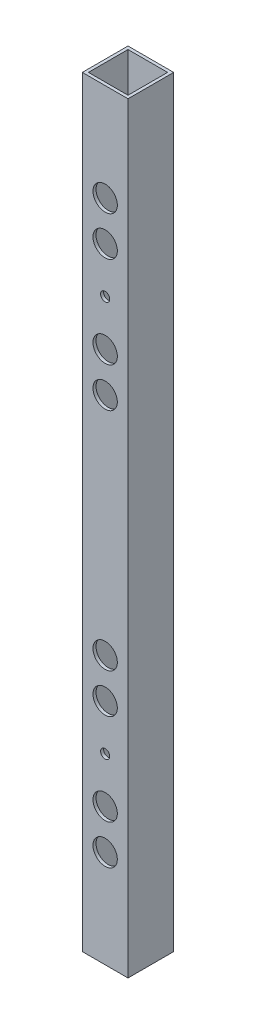
from build123d import *

# Parameters (mm, degrees)
SKETCH_1_W          = 15
SKETCH_1_H          = 15
SKETCH_1_W_2        = 13
SKETCH_1_H_2        = 13
EXTRUDE_1_DEPTH     = 250
SKETCH_2_R          = 1.5
CUT_EXTRUDE_1_DEPTH = 250
SKETCH_3_R          = 4
CUT_EXTRUDE_2_DEPTH = 2
SKETCH_4_R          = 4
CUT_EXTRUDE_3_DEPTH = 2


with BuildPart() as part:
    # 草图1 → 凸台-拉伸1 (new body)
    with BuildSketch(Plane(origin=(0, 0, 0), x_dir=(1, 0, 0), z_dir=(0, 1, 0))):
        Rectangle(SKETCH_1_W, SKETCH_1_H)
        Rectangle(SKETCH_1_W_2, SKETCH_1_H_2, mode=Mode.SUBTRACT)
    extrude(amount=EXTRUDE_1_DEPTH)

    # 草图2 → 切除-拉伸1 (cut)
    with BuildSketch(Plane(origin=(0, 0, -7.5), x_dir=(-1, 0, 0), z_dir=(0, 0, -1))):
        with Locations((0, 190)):
            Circle(SKETCH_2_R)
        with Locations((0, 205)):
            Circle(SKETCH_2_R)
        with Locations((0, 218)):
            Circle(SKETCH_2_R)
        with Locations((0, 175)):
            Circle(SKETCH_2_R)
        with Locations((0, 162)):
            Circle(SKETCH_2_R)
        with Locations(Location((0, 88, 0), (0, 0, 180))):
            Circle(SKETCH_2_R)
        with Locations(Location((0, 75, 0), (0, 0, 180))):
            Circle(SKETCH_2_R)
        with Locations(Location((0, 32, 0), (0, 0, 180))):
            Circle(SKETCH_2_R)
        with Locations(Location((0, 45, 0), (0, 0, 180))):
            Circle(SKETCH_2_R)
        with Locations(Location((0, 60, 0), (0, 0, 180))):
            Circle(SKETCH_2_R)
    extrude(amount=-CUT_EXTRUDE_1_DEPTH, mode=Mode.SUBTRACT)

    # 草图3 → 切除-拉伸2 (cut)
    with BuildSketch(Plane(origin=(0, 0, -7.5), x_dir=(-1, 0, 0), z_dir=(0, 0, -1))):
        with Locations((0, 60)):
            Circle(SKETCH_3_R)
        with Locations((0, 190)):
            Circle(SKETCH_3_R)
    extrude(amount=-CUT_EXTRUDE_2_DEPTH, mode=Mode.SUBTRACT)

    # 草图4 → 切除-拉伸3 (cut)
    with BuildSketch(Plane.XY.offset(7.5)):
        with Locations((0, 218)):
            Circle(SKETCH_4_R)
        with Locations((0, 205)):
            Circle(SKETCH_4_R)
        with Locations((0, 175)):
            Circle(SKETCH_4_R)
        with Locations((0, 162)):
            Circle(SKETCH_4_R)
        with Locations(Location((0, 88, 0), (0, 0, 180))):
            Circle(SKETCH_4_R)
        with Locations(Location((0, 75, 0), (0, 0, 180))):
            Circle(SKETCH_4_R)
        with Locations(Location((0, 45, 0), (0, 0, 180))):
            Circle(SKETCH_4_R)
        with Locations(Location((0, 32, 0), (0, 0, 180))):
            Circle(SKETCH_4_R)
    extrude(amount=-CUT_EXTRUDE_3_DEPTH, mode=Mode.SUBTRACT)


solid = part.part
